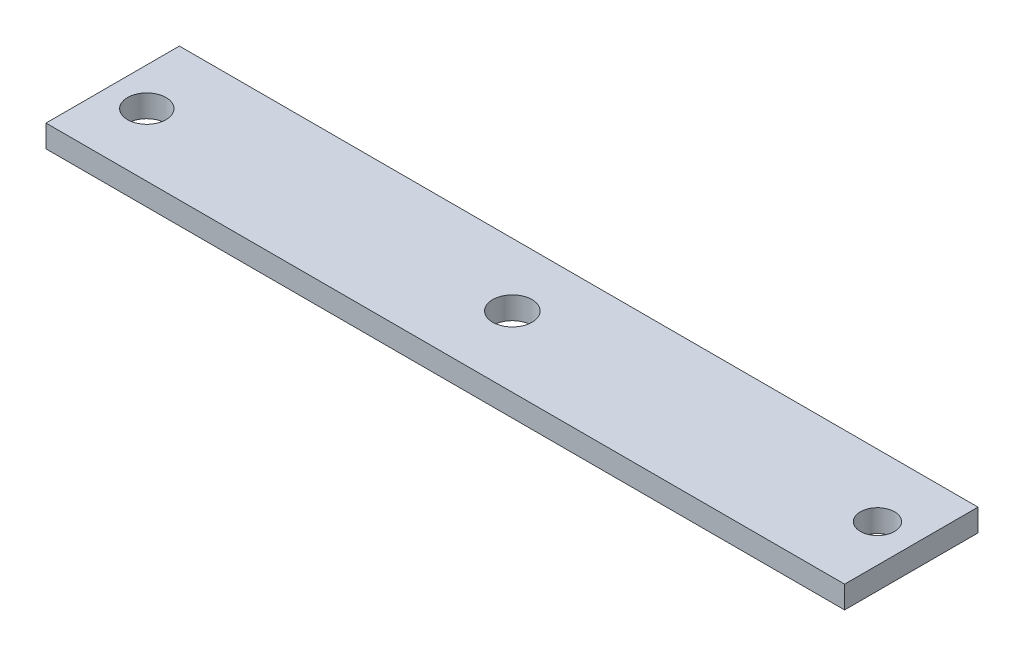
from build123d import *

# Parameters (mm, degrees)
SKETCH1_W           = 92.8
SKETCH1_H           = 15.5
SKETCH1_R           = 2.2355
SKETCH1_R_2         = 2.285
SKETCH1_R_3         = 1.985
BOSS_EXTRUDE1_DEPTH = 2.6


with BuildPart() as part:
    # Sketch1 → Boss-Extrude1 (new body)
    with BuildSketch(Plane(origin=(0, 0, 0), x_dir=(1, 0, 0), z_dir=(0, 1, 0))):
        with Locations((13.031944444, 1.130208333)):
            Rectangle(SKETCH1_W, SKETCH1_H)
        with Locations(Location((-28.968055556, 0.690208333, 0), (0, 0, 270))):
            Circle(SKETCH1_R, mode=Mode.SUBTRACT)
        with Locations(Location((12.631944444, 1.570208333, 0), (0, 0, 270))):
            Circle(SKETCH1_R_2, mode=Mode.SUBTRACT)
        with Locations(Location((55.051944444, 1.580208333, 0), (0, 0, 270))):
            Circle(SKETCH1_R_3, mode=Mode.SUBTRACT)
    extrude(amount=BOSS_EXTRUDE1_DEPTH)


solid = part.part
